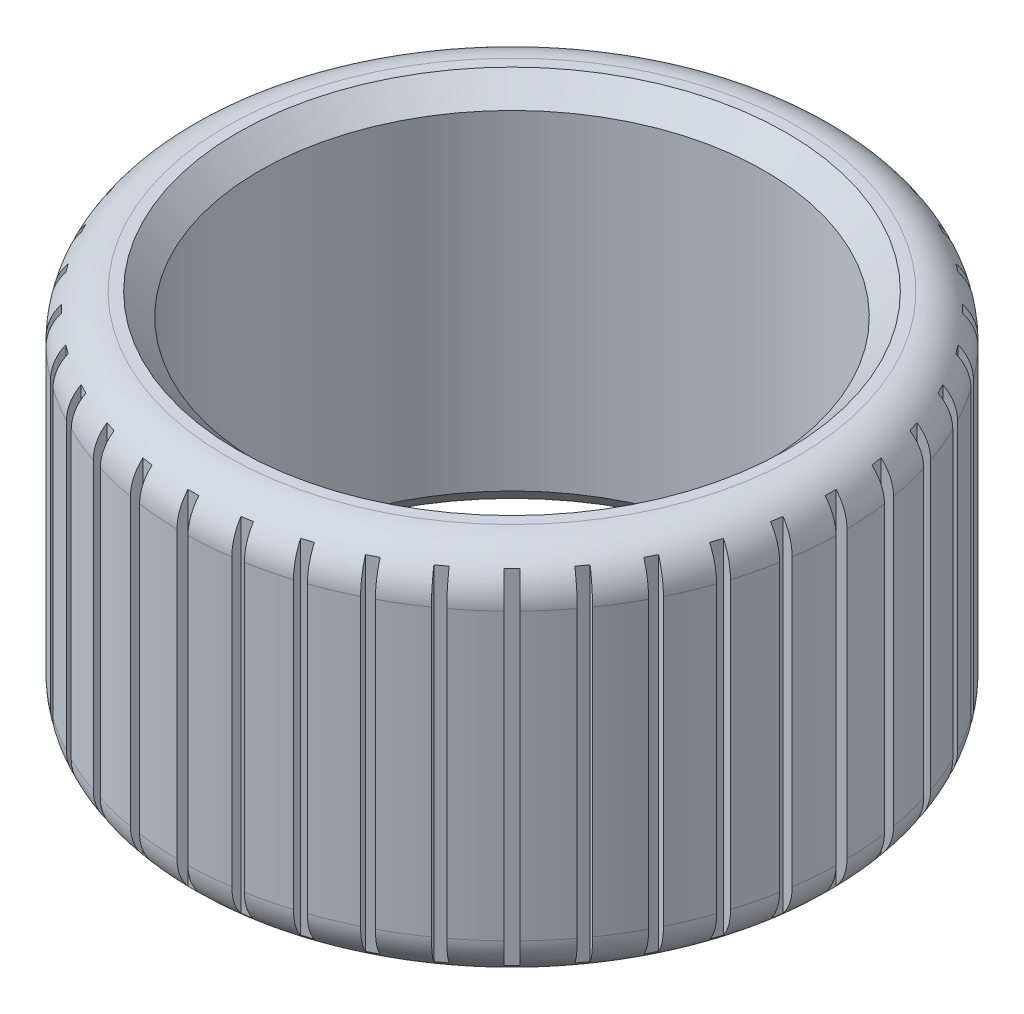
from build123d import *

# Parameters (mm, degrees)
SKETCH1_R           = 30
SKETCH1_R_2         = 23
BOSS_EXTRUDE1_DEPTH = 34
CHAMFER1_SIZE       = 2
FILLET3_R           = 4
SKETCH2_W           = 1
SKETCH2_H           = 2
SKETCH2_W_2         = 2
SKETCH2_H_2         = 1
CUT_EXTRUDE1_DEPTH  = 34


with BuildPart() as part:
    # Sketch1 → Boss-Extrude1 (new body)
    with BuildSketch(Plane(origin=(0, 0, 0), x_dir=(1, 0, 0), z_dir=(0, 1, 0))):
        with Locations(Location((0, 0, 0), (0, 0, 270))):
            Circle(SKETCH1_R)
        with Locations(Location((0, 0, 0), (0, 0, 270))):
            Circle(SKETCH1_R_2, mode=Mode.SUBTRACT)
    extrude(amount=BOSS_EXTRUDE1_DEPTH)

    # Chamfer1
    chamfer1_edges = [part.edges().sort_by_distance(p)[0] for p in [
        (0, 0, -23),
        (0, 34, -23),
    ]]
    chamfer(chamfer1_edges, length=CHAMFER1_SIZE)

    # Fillet3
    fillet3_edges = [part.edges().sort_by_distance(p)[0] for p in [
        (0, 0, -30),
        (0, 34, -30),
    ]]
    fillet(fillet3_edges, radius=FILLET3_R)

    # Sketch2 → Cut-Extrude1 (cut)
    with BuildSketch(Plane(origin=(0, 34, 0), x_dir=(1, 0, 0), z_dir=(0, 1, 0))):
        Polygon((4.355624246, 30.696555791), (4.042755316, 28.72117911), (5.030443656, 28.564744645), (5.343312587, 30.540121326), align=None)
        with Locations((0, 30)):
            Rectangle(SKETCH2_W, SKETCH2_H)
        Polygon((9.103998567, 29.637260502), (8.485964579, 27.73514747), (9.437021095, 27.426130475), (10.055055084, 29.328243508), align=None)
        Polygon((13.62820223, 27.8481975), (12.72022123, 26.066184451), (13.611227755, 25.612193952), (14.519208754, 27.394207), align=None)
        Polygon((17.816834324, 25.373419452), (16.641263819, 23.755385463), (17.450280814, 23.167600211), (18.625851318, 24.785634199), align=None)
        Polygon((21.566756826, 22.273863607), (20.152543264, 20.859650045), (20.859650045, 20.152543264), (22.273863607, 21.566756826), align=None)
        Polygon((24.785634199, 18.625851318), (23.167600211, 17.450280814), (23.755385463, 16.641263819), (25.373419452, 17.816834324), align=None)
        Polygon((27.394207, 14.519208754), (25.612193952, 13.611227755), (26.066184451, 12.72022123), (27.8481975, 13.62820223), align=None)
        Polygon((29.328243508, 10.055055084), (27.426130475, 9.437021095), (27.73514747, 8.485964579), (29.637260502, 9.103998567), align=None)
        Polygon((30.540121326, 5.343312587), (28.564744645, 5.030443656), (28.72117911, 4.042755316), (30.696555791, 4.355624246), align=None)
        with Locations((30, 0)):
            Rectangle(SKETCH2_W_2, SKETCH2_H_2)
        Polygon((30.696555791, -4.355624246), (28.72117911, -4.042755316), (28.564744645, -5.030443656), (30.540121326, -5.343312587), align=None)
        Polygon((29.637260502, -9.103998567), (27.73514747, -8.485964579), (27.426130475, -9.437021095), (29.328243508, -10.055055084), align=None)
        Polygon((27.8481975, -13.62820223), (26.066184451, -12.72022123), (25.612193952, -13.611227755), (27.394207, -14.519208754), align=None)
        Polygon((25.373419452, -17.816834324), (23.755385463, -16.641263819), (23.167600211, -17.450280814), (24.785634199, -18.625851318), align=None)
        Polygon((22.273863607, -21.566756826), (20.859650045, -20.152543264), (20.152543264, -20.859650045), (21.566756826, -22.273863607), align=None)
        Polygon((18.625851318, -24.785634199), (17.450280814, -23.167600211), (16.641263819, -23.755385463), (17.816834324, -25.373419452), align=None)
        Polygon((14.519208754, -27.394207), (13.611227755, -25.612193952), (12.72022123, -26.066184451), (13.62820223, -27.8481975), align=None)
        Polygon((10.055055084, -29.328243508), (9.437021095, -27.426130475), (8.485964579, -27.73514747), (9.103998567, -29.637260502), align=None)
        Polygon((5.343312587, -30.540121326), (5.030443656, -28.564744645), (4.042755316, -28.72117911), (4.355624246, -30.696555791), align=None)
        with Locations((0, -30)):
            Rectangle(SKETCH2_W, SKETCH2_H)
        Polygon((-4.355624246, -30.696555791), (-4.042755316, -28.72117911), (-5.030443656, -28.564744645), (-5.343312587, -30.540121326), align=None)
        Polygon((-9.103998567, -29.637260502), (-8.485964579, -27.73514747), (-9.437021095, -27.426130475), (-10.055055084, -29.328243508), align=None)
        Polygon((-13.62820223, -27.8481975), (-12.72022123, -26.066184451), (-13.611227755, -25.612193952), (-14.519208754, -27.394207), align=None)
        Polygon((-17.816834324, -25.373419452), (-16.641263819, -23.755385463), (-17.450280814, -23.167600211), (-18.625851318, -24.785634199), align=None)
        Polygon((-21.566756826, -22.273863607), (-20.152543264, -20.859650045), (-20.859650045, -20.152543264), (-22.273863607, -21.566756826), align=None)
        Polygon((-24.785634199, -18.625851318), (-23.167600211, -17.450280814), (-23.755385463, -16.641263819), (-25.373419452, -17.816834324), align=None)
        Polygon((-27.394207, -14.519208754), (-25.612193952, -13.611227755), (-26.066184451, -12.72022123), (-27.8481975, -13.62820223), align=None)
        Polygon((-29.328243508, -10.055055084), (-27.426130475, -9.437021095), (-27.73514747, -8.485964579), (-29.637260502, -9.103998567), align=None)
        Polygon((-30.540121326, -5.343312587), (-28.564744645, -5.030443656), (-28.72117911, -4.042755316), (-30.696555791, -4.355624246), align=None)
        with Locations((-30, 0)):
            Rectangle(SKETCH2_W_2, SKETCH2_H_2)
        Polygon((-30.696555791, 4.355624246), (-28.72117911, 4.042755316), (-28.564744645, 5.030443656), (-30.540121326, 5.343312587), align=None)
        Polygon((-29.637260502, 9.103998567), (-27.73514747, 8.485964579), (-27.426130475, 9.437021095), (-29.328243508, 10.055055084), align=None)
        Polygon((-27.8481975, 13.62820223), (-26.066184451, 12.72022123), (-25.612193952, 13.611227755), (-27.394207, 14.519208754), align=None)
        Polygon((-25.373419452, 17.816834324), (-23.755385463, 16.641263819), (-23.167600211, 17.450280814), (-24.785634199, 18.625851318), align=None)
        Polygon((-22.273863607, 21.566756826), (-20.859650045, 20.152543264), (-20.152543264, 20.859650045), (-21.566756826, 22.273863607), align=None)
        Polygon((-18.625851318, 24.785634199), (-17.450280814, 23.167600211), (-16.641263819, 23.755385463), (-17.816834324, 25.373419452), align=None)
        Polygon((-14.519208754, 27.394207), (-13.611227755, 25.612193952), (-12.72022123, 26.066184451), (-13.62820223, 27.8481975), align=None)
        Polygon((-10.055055084, 29.328243508), (-9.437021095, 27.426130475), (-8.485964579, 27.73514747), (-9.103998567, 29.637260502), align=None)
        Polygon((-5.343312587, 30.540121326), (-5.030443656, 28.564744645), (-4.042755316, 28.72117911), (-4.355624246, 30.696555791), align=None)
    extrude(amount=-CUT_EXTRUDE1_DEPTH, mode=Mode.SUBTRACT)


solid = part.part
